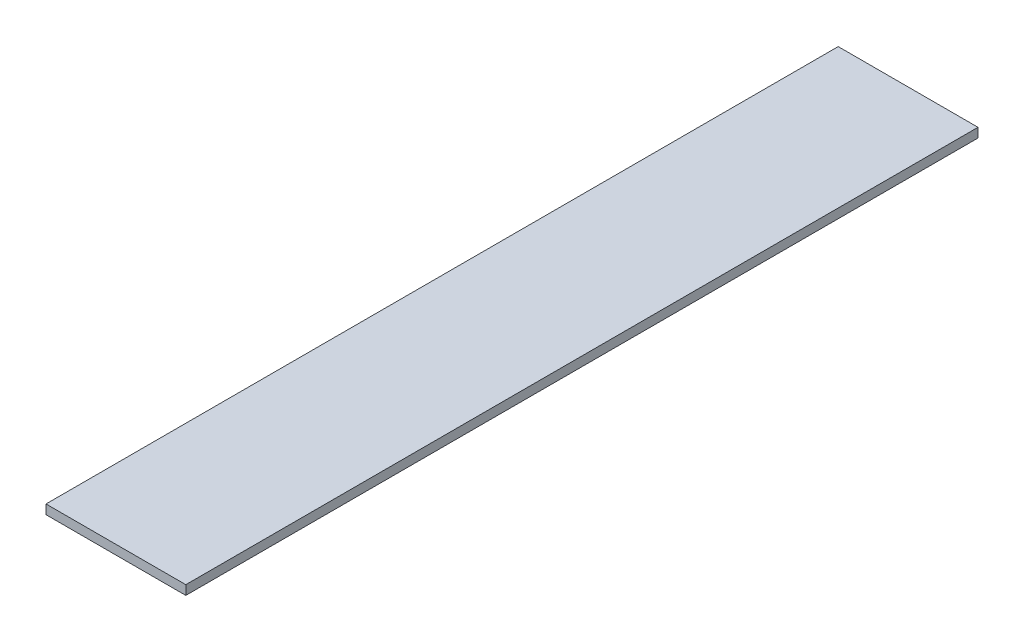
from build123d import *

# Parameters (mm, degrees)
SKETCH1_W           = 15
SKETCH1_H           = 85
BOSS_EXTRUDE1_DEPTH = 1


with BuildPart() as part:
    # Sketch1 → Boss-Extrude1 (new body)
    with BuildSketch(Plane(origin=(0, 0, 0), x_dir=(1, 0, 0), z_dir=(0, 1, 0))):
        with Locations((7.5, 42.5)):
            Rectangle(SKETCH1_W, SKETCH1_H)
    extrude(amount=BOSS_EXTRUDE1_DEPTH)


solid = part.part
